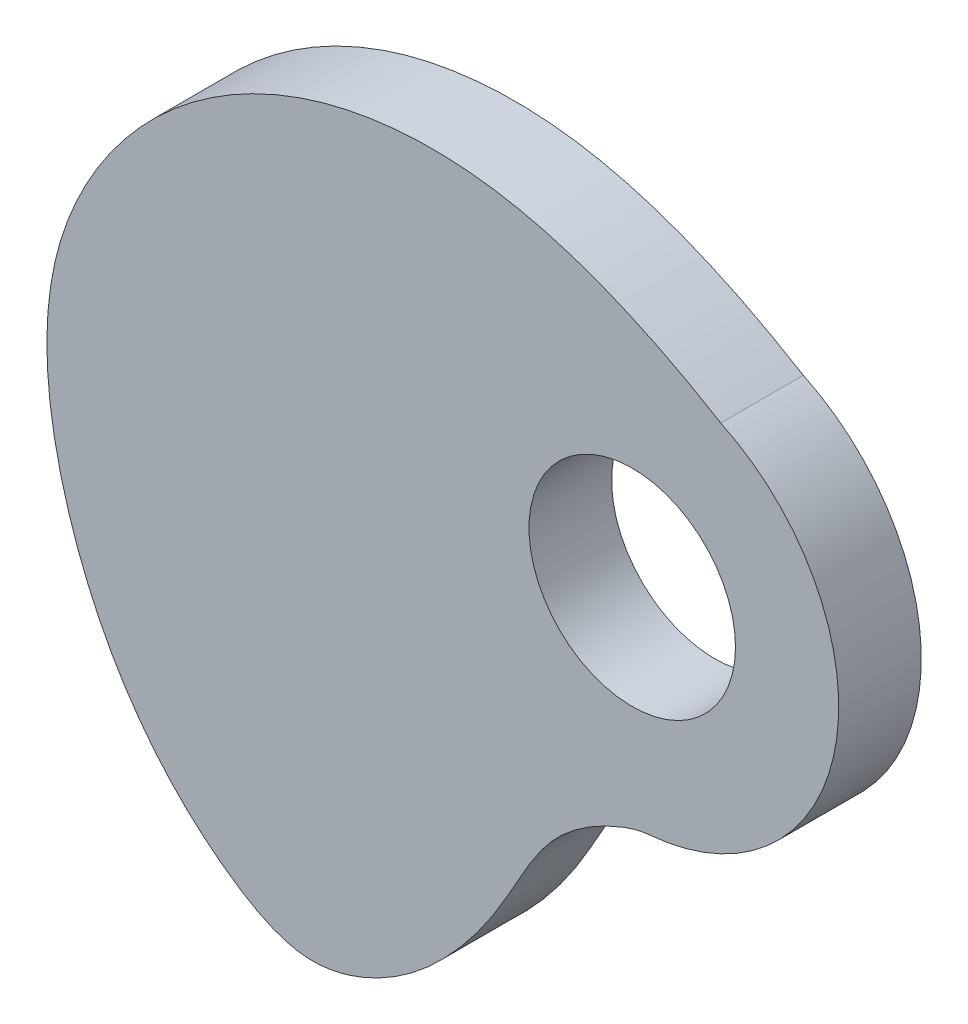
from build123d import *

# Parameters (mm, degrees)
BOSS_EXTRUDE3_DEPTH = 5
SKETCH23_R          = 12.5
CUT_EXTRUDE2_DEPTH  = 5


with BuildPart() as part:
    # CAM Profile → Boss-Extrude3 (new, symmetric)
    with BuildSketch(Plane.XY):
        with BuildLine():
            ThreePointArc((2.015005174, -24.918662768), (24.591101671, -4.50307879), (10.714285393, 22.587697725))
            add(Edge.make_bspline(
                [(10.714285393, 22.587697725), (1.976827133, 27.888880105), (-14.291395178, 35.18878552), (-39.908755362, 33.144388668), (-59.892319743, 21.093031868), (-72.481083115, -0.64025331), (-69.624108687, -29.611263522), (-56.788220815, -50.664604845), (-39.784583476, -59.796245584), (-29.771883474, -56.574931838), (-21.815056049, -49.893681054), (-15.299711907, -41.012215147), (-10.689816915, -31.00562683), (-3.413441312, -26.374725684), (0.852841277, -25.01263917), (2.015005174, -24.918662768)],
                knots=[0, 0, 0, 0, 0.138431915, 0.230574402, 0.333853064, 0.440155637, 0.54794121, 0.709692363, 0.750139005, 0.793812962, 0.839921431, 0.888980107, 0.940790066, 0.984264013, 1, 1, 1, 1], degree=3))
        make_face()
    extrude(amount=BOSS_EXTRUDE3_DEPTH, both=True)

    # Sketch23 → Cut-Extrude2 (cut, symmetric)
    with BuildSketch(Plane.XY):
        Circle(SKETCH23_R)
    extrude(amount=CUT_EXTRUDE2_DEPTH, both=True, mode=Mode.SUBTRACT)


solid = part.part
